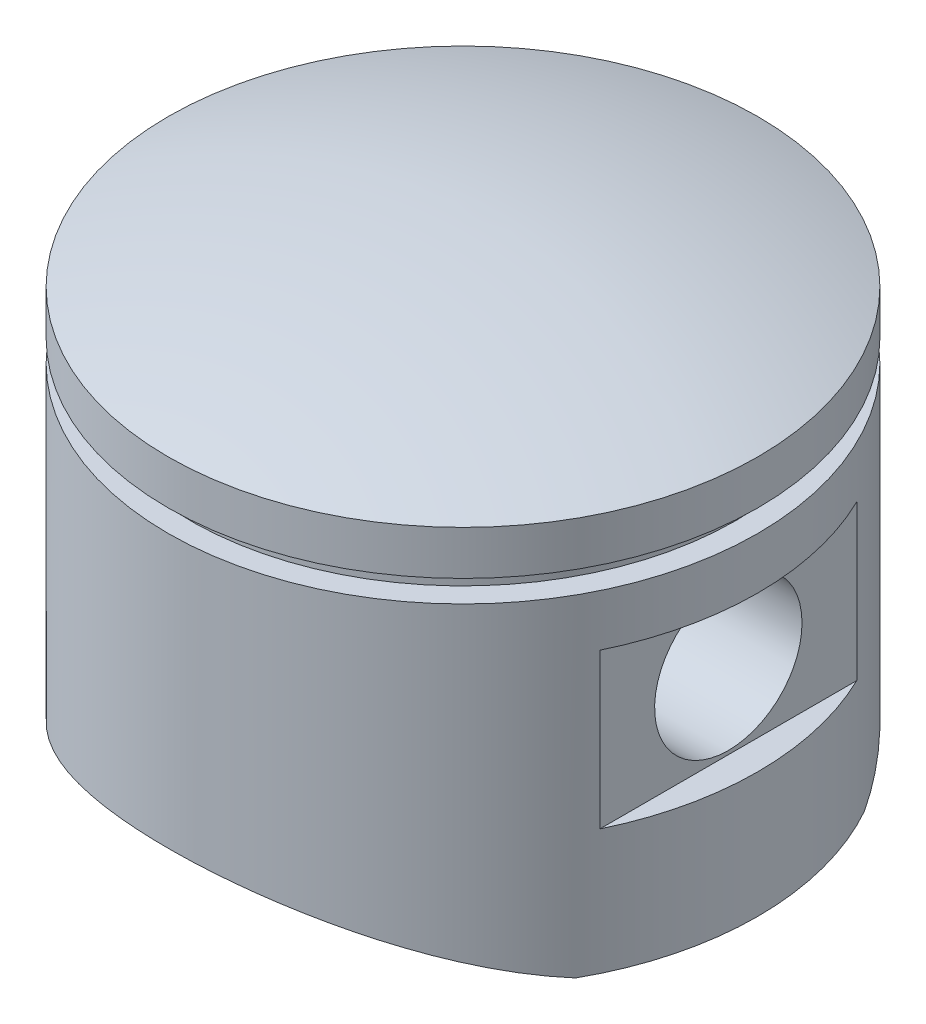
from build123d import *

# Parameters (mm, degrees)
CUT_EXTRUDE1_DEPTH      = 1987.403423275
CUT_EXTRUDE1_DEPTH_BACK = 1987.403423275
SKETCH2_W               = 225.307580662
SKETCH2_H               = 533.4
BOSS_EXTRUDE1_START     = 889
BOSS_EXTRUDE1_DEPTH     = 889
SKETCH4_W               = 635
SKETCH4_H               = 812.8
BOSS_EXTRUDE2_DEPTH     = 254
FILLET1_R               = 314.96
FILLET1_OF_MIRROR1_R    = 314.96
CUT_EXTRUDE2_DEPTH      = 1987.403423275
CUT_EXTRUDE2_DEPTH_BACK = 1987.403423275
SKETCH5_R               = 254
CUT_EXTRUDE3_DEPTH      = 1987.403423275
CUT_EXTRUDE3_DEPTH_BACK = 1987.403423275
SKETCH6_R               = 2032
DOME1_FACE_RADIUS       = 1016
DOME1_HEIGHT            = 177.8
FILLET2_R               = 25.4


with BuildPart() as part:
    # Sketch1 → Revolve1 (revolve)
    with BuildSketch(Plane.XY):
        Polygon((1016, 0), (1016, 1143), (939.8, 1143), (939.8, 1219.2), (1016, 1219.2), (1016, 1371.6), (0, 1371.6), (0, 1193.8), (838.2, 1193.8), (838.2, 304.8), (939.8, 304.8), (939.8, 0), align=None)
    revolve(axis=Axis((0, 0, 0), (0, 1, 0)))

    # Sketch2 → Cut-Extrude1 (cut, two sides: drawn at the far end of the back side and taken through both)
    with BuildSketch(Plane.XY.offset(-CUT_EXTRUDE1_DEPTH_BACK)):
        with Locations((-1027.053790331, 698.5)):
            Rectangle(SKETCH2_W, SKETCH2_H)
        with Locations((1027.053790331, 698.5)):
            Rectangle(SKETCH2_W, SKETCH2_H)
    extrude(amount=CUT_EXTRUDE1_DEPTH + CUT_EXTRUDE1_DEPTH_BACK, mode=Mode.SUBTRACT)

    # Sketch3 → Boss-Extrude1 (add)
    with BuildSketch(Plane.XZ.offset(-1193.8).offset(BOSS_EXTRUDE1_START)):
        with BuildLine():
            Line((-711.2, 443.591929593), (-711.2, -443.591929593))
            ThreePointArc((-711.2, -443.591929593), (-838.2, 0), (-711.2, 443.591929593))
        make_face()
        with BuildLine():
            Line((711.2, 443.591929593), (711.2, -443.591929593))
            ThreePointArc((711.2, -443.591929593), (838.2, 0), (711.2, 443.591929593))
        make_face()
    extrude(amount=-BOSS_EXTRUDE1_DEPTH)

    # Sketch4 → Boss-Extrude2 (add)
    with BuildSketch(Plane.ZY.offset(-711.2)):
        with Locations((0, 787.4)):
            Rectangle(SKETCH4_W, SKETCH4_H)
    boss_extrude2 = extrude(amount=BOSS_EXTRUDE2_DEPTH)

    # Fillet1
    fillet1_edges = [part.edges().sort_by_distance(p)[0] for p in [
        (584.2, 381, 317.5),
        (584.2, 381, -317.5),
    ]]
    fillet(fillet1_edges, radius=FILLET1_R)

    # Mirror1: Boss-Extrude2 across plane
    add(boss_extrude2.mirror(Plane(origin=(0, 0, 0), x_dir=(0, 0, 1), z_dir=(1, 0, 0))))

    # Fillet1 of Mirror1
    fillet1_of_mirror1_edges = [part.edges().sort_by_distance(p)[0] for p in [
        (-584.2, 381, 317.5),
        (-584.2, 381, -317.5),
    ]]
    fillet(fillet1_of_mirror1_edges, radius=FILLET1_OF_MIRROR1_R)

    # Sketch5 → Cut-Extrude2 (cut, two sides: drawn at the far end of the back side and taken through both)
    with BuildSketch(Plane(origin=(0, 0, 0), x_dir=(0, 0, -1), z_dir=(1, 0, 0)).offset(-CUT_EXTRUDE2_DEPTH_BACK)):
        with Locations(Location((0, 698.5, 0), (0, 0, 90))):
            Circle(SKETCH5_R)
    extrude(amount=CUT_EXTRUDE2_DEPTH + CUT_EXTRUDE2_DEPTH_BACK, mode=Mode.SUBTRACT)

    # Sketch6 → Cut-Extrude3 (cut, two sides: drawn at the far end of the back side and taken through both)
    with BuildSketch(Plane.XY.offset(-CUT_EXTRUDE3_DEPTH_BACK)):
        with Locations((0, -1828.8)):
            Circle(SKETCH6_R)
    extrude(amount=CUT_EXTRUDE3_DEPTH + CUT_EXTRUDE3_DEPTH_BACK, mode=Mode.SUBTRACT)

    # Dome1: a dome of height H over a round flat face of radius A is a cap of a sphere of radius (A * A + H * H) / (2 * H)
    dome1_r = (DOME1_FACE_RADIUS * DOME1_FACE_RADIUS + DOME1_HEIGHT * DOME1_HEIGHT) / (2 * DOME1_HEIGHT)
    dome1_base = Plane((0, 1371.6, 0), z_dir=(0, 1, 0))
    with Locations(dome1_base.offset(DOME1_HEIGHT - dome1_r)):
        dome1_ball = Sphere(dome1_r, mode=Mode.PRIVATE)
    add(split(dome1_ball, bisect_by=dome1_base, keep=Keep.TOP, mode=Mode.PRIVATE))

    # Fillet2
    fillet2_edges = [part.edges().sort_by_distance(p)[0] for p in [
        (457.2, 944.88, -317.5),
        (457.2, 944.88, 317.5),
        (457.2, 381, 0),
        (457.2, 473.249648197, -225.250351803),
        (457.2, 473.249648197, 225.250351803),
        (-457.2, 944.88, -317.5),
        (-457.2, 381, 0),
        (-457.2, 944.88, 317.5),
        (-457.2, 473.249648197, -225.250351803),
        (-457.2, 473.249648197, 225.250351803),
    ]]
    fillet(fillet2_edges, radius=FILLET2_R)


solid = part.part
